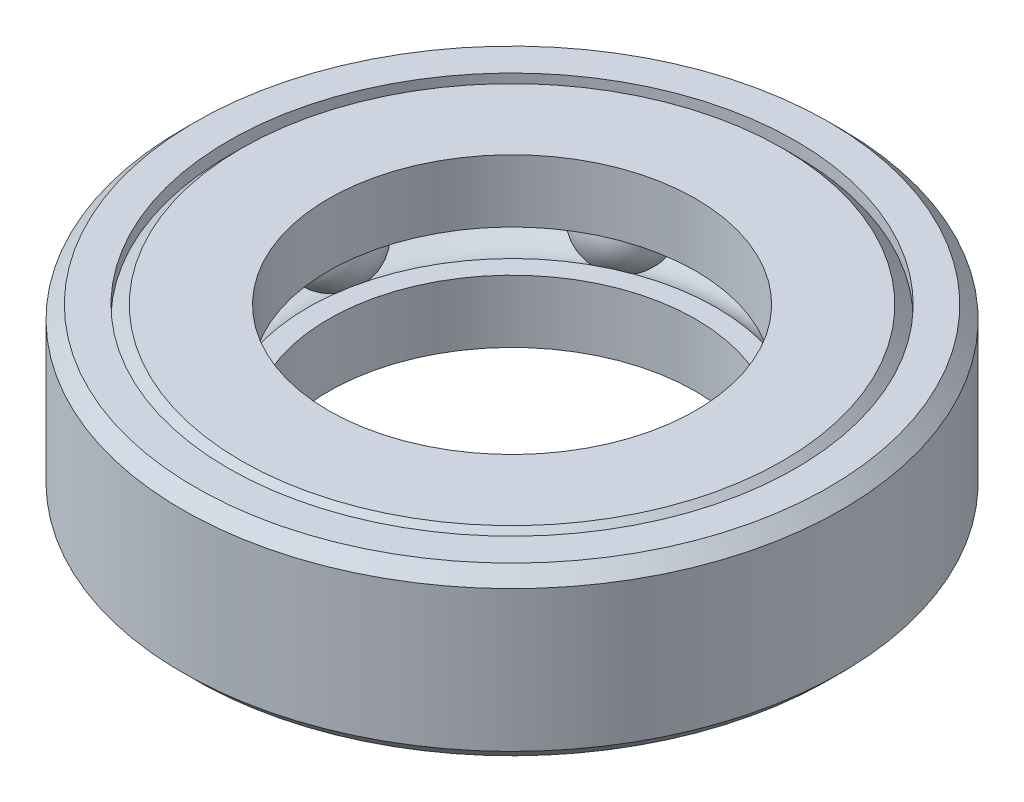
from build123d import *

# Parameters (mm, degrees)
CIRPATTERN1_COUNT = 7


with BuildPart() as part:
    # Sketch2 → Revolve1 (revolve)
    with BuildSketch(Plane(origin=(0, 0, 0), x_dir=(0, 0, -1), z_dir=(1, 0, 0)), mode=Mode.PRIVATE) as revolve1_sk:
        with BuildLine():
            Line((-26.277194571, 1.984375), (-28.2178125, 1.984375))
            Line((-28.2178125, 1.984375), (-28.2178125, 5.471634886))
            Line((-28.2178125, 5.471634886), (-25.751947386, 7.9375))
            Line((-25.751947386, 7.9375), (-17.4625, 7.9375))
            Line((-17.4625, 7.9375), (-17.4625, 1.984375))
            Line((-17.4625, 1.984375), (-19.403117929, 1.984375))
            ThreePointArc((-19.403117929, 1.984375), (-22.84015625, 3.96875), (-26.277194571, 1.984375))
        make_face()
        with BuildLine():
            Line((-17.4625, -1.984375), (-19.403117929, -1.984375))
            ThreePointArc((-19.403117929, -1.984375), (-22.84015625, -3.96875), (-26.277194571, -1.984375))
            Line((-26.277194571, -1.984375), (-28.2178125, -1.984375))
            Line((-28.2178125, -1.984375), (-28.2178125, -5.471634886))
            Line((-28.2178125, -5.471634886), (-25.751947386, -7.9375))
            Line((-25.751947386, -7.9375), (-17.4625, -7.9375))
            Line((-17.4625, -7.9375), (-17.4625, -1.984375))
        make_face()
    revolve(revolve1_sk.sketch.rotate(Axis((0, -7.9375, 0), (0, 1, 0)), 180), axis=Axis((0, -7.9375, 0), (0, 1, 0)))


with BuildPart() as body_2:
    # Sketch3 → Revolve2 (revolve)
    with BuildSketch(Plane(origin=(0, 0, 0), x_dir=(0, 0, -1), z_dir=(1, 0, 0)), mode=Mode.PRIVATE) as revolve2_sk:
        Polygon((-26.984879943, 6.704567443), (-26.984879943, 7.9375), (-30.120192443, 7.9375), (-31.353125, 6.704567443), (-31.353125, -6.704567443), (-30.120192443, -7.9375), (-26.984879943, -7.9375), (-26.984879943, -6.704567443), (-28.2178125, -5.471634886), (-28.2178125, 5.471634886), align=None)
    revolve(revolve2_sk.sketch.rotate(Axis((0, -7.9375, 0), (0, 1, 0)), 180), axis=Axis((0, -7.9375, 0), (0, 1, 0)))


with BuildPart() as body_3:
    # Sketch4 → Revolve3 (revolve)
    with BuildSketch(Plane(origin=(0, 0, 0), x_dir=(0, 0, -1), z_dir=(1, 0, 0))):
        with BuildLine():
            Line((-22.84015625, 3.96875), (-22.84015625, -3.96875))
            ThreePointArc((-22.84015625, -3.96875), (-18.87140625, 0), (-22.84015625, 3.96875))
        make_face()
    revolve(axis=Axis((0, 3.96875, 22.84015625), (0, -1, 0)))


with BuildPart() as cirpattern1_1:
    # CirPattern1: pattern copy
    add(body_3.part.rotate(Axis((0, 0, 0), (0, 1, 0)), 1 * 360 / CIRPATTERN1_COUNT))


with BuildPart() as cirpattern1_2:
    # CirPattern1: pattern copy
    add(body_3.part.rotate(Axis((0, 0, 0), (0, 1, 0)), 2 * 360 / CIRPATTERN1_COUNT))


with BuildPart() as cirpattern1_3:
    # CirPattern1: pattern copy
    add(body_3.part.rotate(Axis((0, 0, 0), (0, 1, 0)), 3 * 360 / CIRPATTERN1_COUNT))


with BuildPart() as cirpattern1_4:
    # CirPattern1: pattern copy
    add(body_3.part.rotate(Axis((0, 0, 0), (0, 1, 0)), 4 * 360 / CIRPATTERN1_COUNT))


with BuildPart() as cirpattern1_5:
    # CirPattern1: pattern copy
    add(body_3.part.rotate(Axis((0, 0, 0), (0, 1, 0)), 5 * 360 / CIRPATTERN1_COUNT))


with BuildPart() as cirpattern1_6:
    # CirPattern1: pattern copy
    add(body_3.part.rotate(Axis((0, 0, 0), (0, 1, 0)), 6 * 360 / CIRPATTERN1_COUNT))


solid = Compound([part.part, body_2.part, body_3.part, cirpattern1_1.part, cirpattern1_2.part, cirpattern1_3.part, cirpattern1_4.part, cirpattern1_5.part, cirpattern1_6.part])
